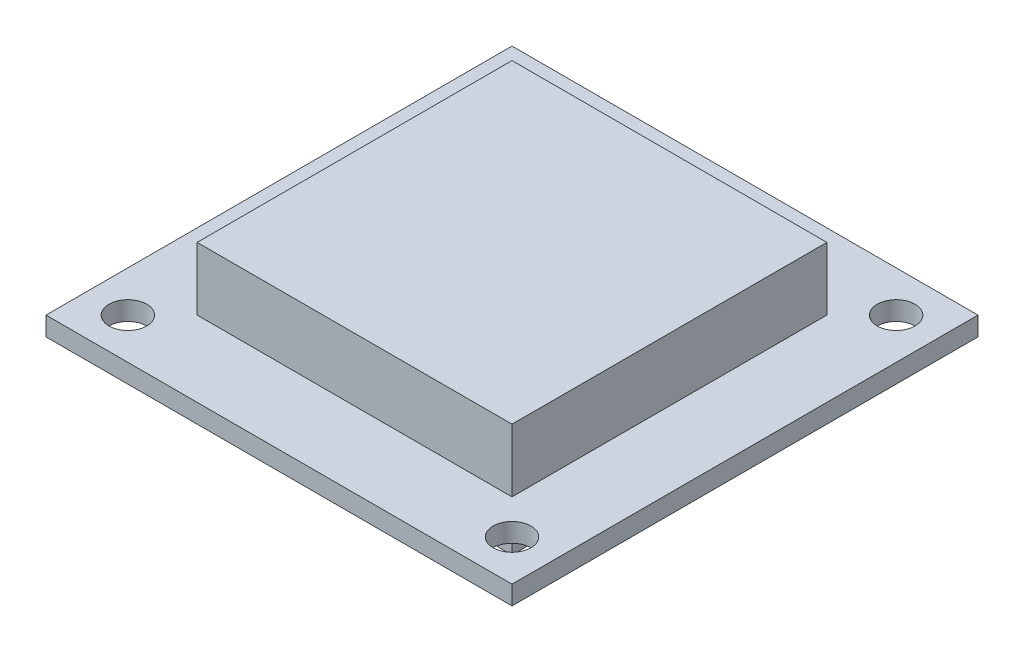
from build123d import *

# Parameters (mm, degrees)
SKETCH_1_W           = 37
SKETCH_1_H           = 37
SKETCH_1_R           = 1.5
EXTRUDE_1_DEPTH      = 1.5
EXTRUDE_2_DEPTH      = 5
EXTRUDE_2_DEPTH_BACK = 4
SKETCH_2_W           = 25
SKETCH_2_H           = 25


with BuildPart() as part:
    # 草图1 → 凸台-拉伸1 (new body)
    with BuildSketch(Plane(origin=(0, 0, 0), x_dir=(1, 0, 0), z_dir=(0, 1, 0))):
        Rectangle(SKETCH_1_W, SKETCH_1_H)
        with Locations(Location((-15.25, 15.25, 0), (0, 0, 270))):
            Circle(SKETCH_1_R, mode=Mode.SUBTRACT)
        with Locations(Location((15.25, 15.25, 0), (0, 0, 270))):
            Circle(SKETCH_1_R, mode=Mode.SUBTRACT)
        with Locations(Location((15.25, -15.25, 0), (0, 0, 270))):
            Circle(SKETCH_1_R, mode=Mode.SUBTRACT)
        with Locations(Location((-15.25, -15.25, 0), (0, 0, 270))):
            Circle(SKETCH_1_R, mode=Mode.SUBTRACT)
    extrude(amount=EXTRUDE_1_DEPTH)

    # 草图2 → 凸台-拉伸2 (add, two sides: drawn at the far end of the back side and taken through both)
    with BuildSketch(Plane(origin=(0, 1.5, 0), x_dir=(1, 0, 0), z_dir=(0, 1, 0)).offset(-EXTRUDE_2_DEPTH_BACK)):
        Rectangle(SKETCH_2_W, SKETCH_2_H)
    extrude(amount=EXTRUDE_2_DEPTH + EXTRUDE_2_DEPTH_BACK)


solid = part.part
